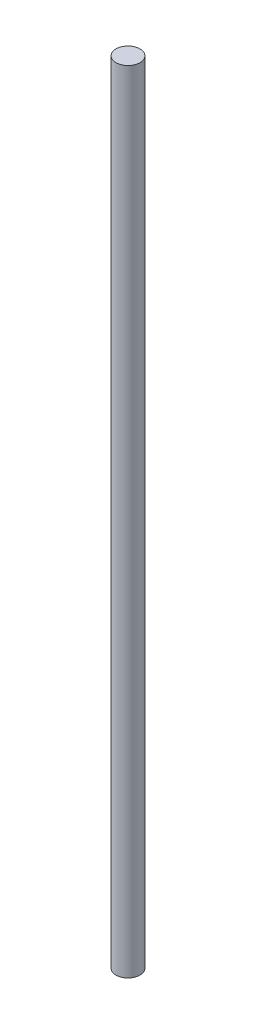
from build123d import *

# Parameters (mm, degrees)
SKETCH1_R           = 4
BOSS_EXTRUDE1_DEPTH = 264


with BuildPart() as part:
    # Sketch1 → Boss-Extrude1 (new body)
    with BuildSketch(Plane(origin=(0, 0, 0), x_dir=(1, 0, 0), z_dir=(0, 1, 0))):
        with Locations(Location((0, 0, 0), (0, 0, 270))):
            Circle(SKETCH1_R)
    extrude(amount=BOSS_EXTRUDE1_DEPTH)


solid = part.part
